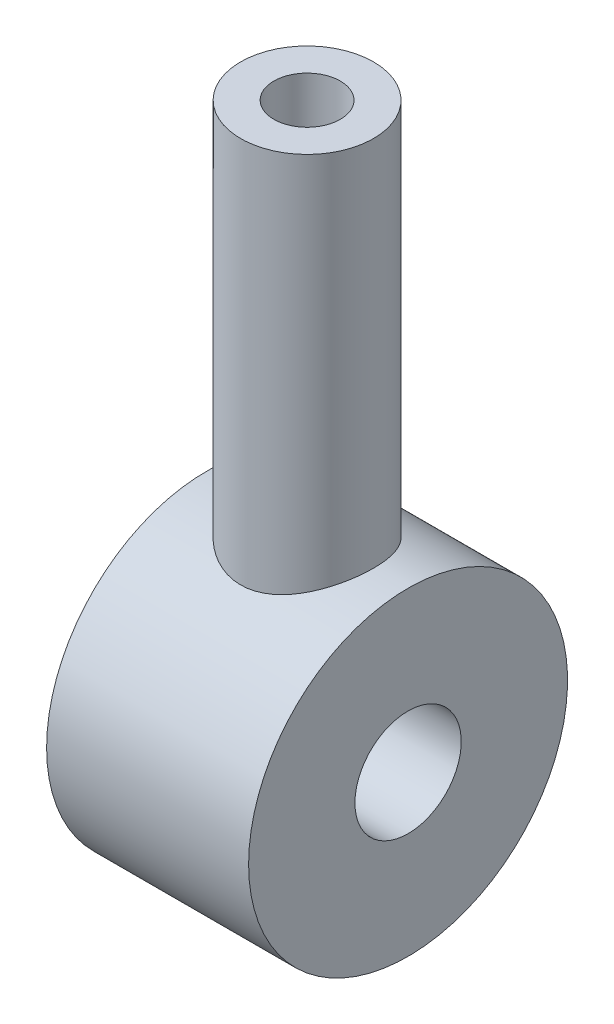
from build123d import *

# Parameters (mm, degrees)
EYE_SKETCH_W = 7.6
EYE_SKETCH_H = 4


with BuildPart() as part:
    # Eye Sketch → Eye (revolve)
    with BuildSketch(Plane.XY):
        with Locations((0, 4)):
            Rectangle(EYE_SKETCH_W, EYE_SKETCH_H)
    revolve(axis=Axis((-3000, 0, 0), (1, 0, 0)))

    # Shank Sketch → Shank (revolve)
    with BuildSketch(Plane.XY):
        Polygon((0, 5), (2.5, 5), (2.5, 20), (1.25, 20), (1.25, 10), (0, 10), align=None)
    revolve(axis=Axis((0, -5, 0), (0, 1, 0)))


solid = part.part
